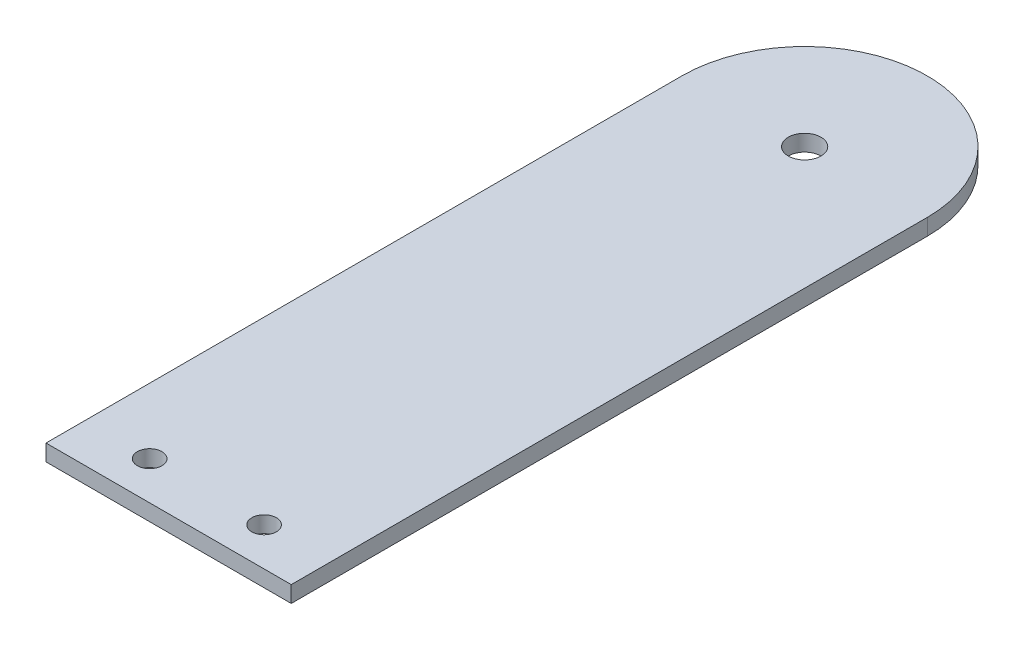
from build123d import *

# Parameters (mm, degrees)
SKETCH_1_R      = 1.5
SKETCH_1_R_2    = 2
EXTRUDE_1_DEPTH = 2


with BuildPart() as part:
    # Эскиз1 → Бобышка-Вытянуть1 (new body)
    with BuildSketch(Plane(origin=(0, 0, 0), x_dir=(1, 0, 0), z_dir=(0, 1, 0))):
        with BuildLine():
            Line((-17.625227915, -29.617278809), (12.374772085, -29.617278809))
            Line((12.374772085, -29.617278809), (12.374772085, 48.182721191))
            ThreePointArc((12.374772085, 48.182721191), (-2.625227915, 63.182721191), (-17.625227915, 48.182721191))
            Line((-17.625227915, 48.182721191), (-17.625227915, -29.617278809))
        make_face()
        with Locations(Location((-9.625227915, -24.937945637, 0), (0, 0, 270))):
            Circle(SKETCH_1_R, mode=Mode.SUBTRACT)
        with Locations(Location((4.374772085, -24.937945637, 0), (0, 0, 270))):
            Circle(SKETCH_1_R, mode=Mode.SUBTRACT)
        with Locations(Location((-2.625227915, 48.182721191, 0), (0, 0, 270))):
            Circle(SKETCH_1_R_2, mode=Mode.SUBTRACT)
    extrude(amount=EXTRUDE_1_DEPTH)


solid = part.part
